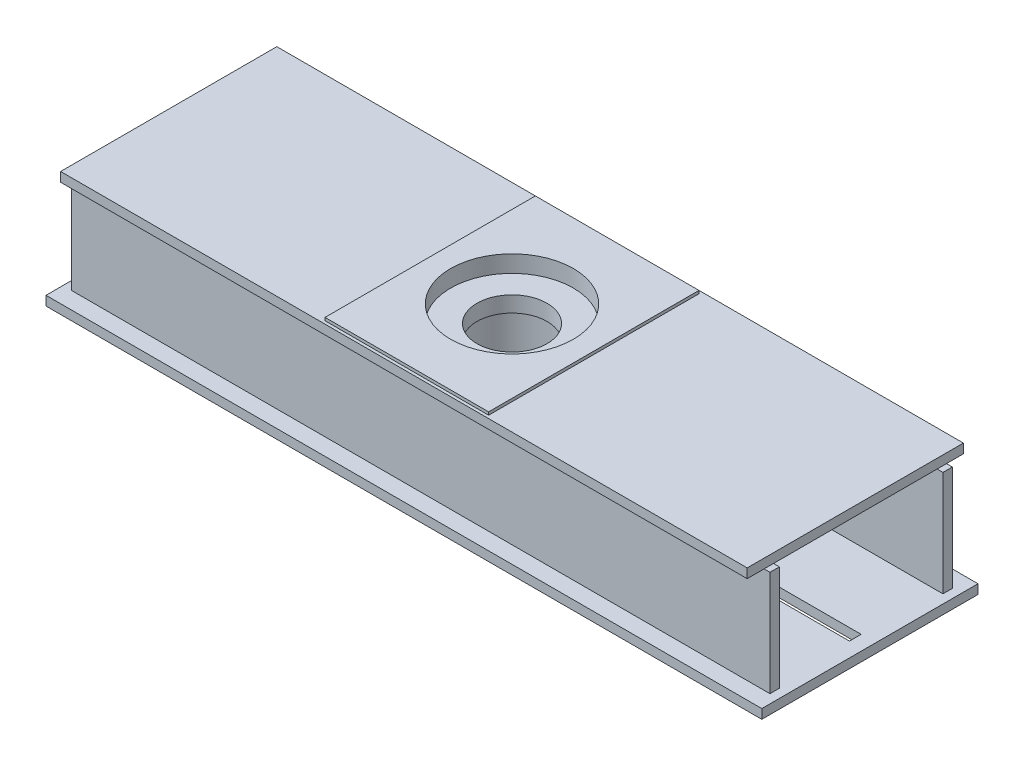
from build123d import *

# Parameters (mm, degrees)
SKETCH_1_W               = 1175
SKETCH_1_H               = 370
SKETCH_1_R               = 105
EXTRUDE_1_DEPTH          = 16
SKETCH_6_W               = 280
SKETCH_6_H               = 360
SKETCH_6_R               = 105
EXTRUDE_5_DEPTH          = 5
EXTRUDE_START            = 8
SKETCH_7_W               = 280
SKETCH_7_H               = 280
SKETCH_7_R               = 105
EXTRUDE_6_DEPTH          = 8
SKETCH_8_W               = 280
SKETCH_8_H               = 280
SKETCH_8_R               = 60
EXTRUDE_7_DEPTH          = 27
SKETCH_9_R               = 85
SKETCH_9_R_2             = 75
EXTRUDE_8_DEPTH          = 135
EXTRUDE_9_DEPTH          = 135
PATTERN_CIRCULAR_1_COUNT = 8
SKETCH_11_W              = 280
SKETCH_11_H              = 280
EXTRUDE_10_DEPTH         = 10
SKETCH_15_W              = 1195
SKETCH_15_H              = 16
EXTRUDE_14_DEPTH         = 180
EXTRUDE_14_2_DEPTH       = 180
SKETCH_16_W              = 1225
SKETCH_16_H              = 370
EXTRUDE_39_DEPTH         = 16
SKETCH_17_W              = 447.5
SKETCH_17_H              = 20
CUT_EXTRUDE_1_DEPTH      = 16


with BuildPart() as part:
    # 草图1 → 凸台-拉伸1 (new body)
    with BuildSketch(Plane(origin=(0, 0, 0), x_dir=(1, 0, 0), z_dir=(0, 1, 0))):
        Rectangle(SKETCH_1_W, SKETCH_1_H)
        with Locations(Location((0, 0, 0), (0, 0, 270))):
            Circle(SKETCH_1_R, mode=Mode.SUBTRACT)
    extrude(amount=EXTRUDE_1_DEPTH)

    # 草图6 → 凸台-拉伸5 (add)
    with BuildSketch(Plane(origin=(0, 16, 0), x_dir=(1, 0, 0), z_dir=(0, 1, 0))):
        Rectangle(SKETCH_6_W, SKETCH_6_H)
        with Locations(Location((0, 0, 0), (0, 0, 270))):
            Circle(SKETCH_6_R, mode=Mode.SUBTRACT)
    extrude(amount=EXTRUDE_5_DEPTH)

    # 草图7 → 凸台-拉伸6 (add)
    with BuildSketch(Plane.XZ.offset(EXTRUDE_START)):
        Rectangle(SKETCH_7_W, SKETCH_7_H)
        with Locations(Location((0, 0, 0), (0, 0, 270))):
            Circle(SKETCH_7_R, mode=Mode.SUBTRACT)
    extrude(amount=-EXTRUDE_6_DEPTH)

    # 草图8 → 凸台-拉伸7 (add)
    with BuildSketch(Plane.XZ.offset(8)):
        Rectangle(SKETCH_8_W, SKETCH_8_H)
        with Locations(Location((0, 0, 0), (0, 0, 270))):
            Circle(SKETCH_8_R, mode=Mode.SUBTRACT)
    extrude(amount=EXTRUDE_7_DEPTH)

    # 草图9 → 凸台-拉伸8 (add)
    with BuildSketch(Plane.XZ.offset(35)):
        with Locations(Location((0, 0, 0), (0, 0, 270))):
            Circle(SKETCH_9_R)
        with Locations(Location((0, 0, 0), (0, 0, 270))):
            Circle(SKETCH_9_R_2, mode=Mode.SUBTRACT)
    extrude(amount=EXTRUDE_8_DEPTH)

    # 草图10 → 凸台-拉伸9 (add)
    with BuildSketch(Plane(origin=(0, -35, 0), x_dir=(-1, 0, 0), z_dir=(0, -1, 0))):
        with BuildLine():
            Line((61.816733056, -136.173165676), (52.577937731, -140))
            Line((52.577937731, -140), (27.852368346, -80.307195054))
            ThreePointArc((27.852368346, -80.307195054), (32.528091751, -78.529760263), (37.091163671, -76.480360731))
            Line((37.091163671, -76.480360731), (61.816733056, -136.173165676))
        make_face()
    extrude_9 = extrude(amount=EXTRUDE_9_DEPTH)

    # 阵列(圆周)1: 凸台-拉伸9 ×8 about axis
    pattern_circular_1_axis = Axis((0, 0, 0), (0, 1, 0))
    for i in range(1, PATTERN_CIRCULAR_1_COUNT):
        add(extrude_9.rotate(pattern_circular_1_axis, i * 360 / PATTERN_CIRCULAR_1_COUNT))

    # 草图11 → 凸台-拉伸10 (add)
    with BuildSketch(Plane.XZ.offset(170)):
        Rectangle(SKETCH_11_W, SKETCH_11_H)
    extrude(amount=EXTRUDE_10_DEPTH)


with BuildPart() as body_2:
    # 草图15 → 凸台-拉伸14 (new body)
    with BuildSketch(Plane(origin=(0, -180, 0), x_dir=(-1, 0, 0), z_dir=(0, -1, 0))):
        with Locations((0, -148)):
            Rectangle(SKETCH_15_W, SKETCH_15_H)
    extrude(amount=-EXTRUDE_14_DEPTH)


with BuildPart() as body_3:
    # 草图15 → Extrude 14 2 (new body)
    with BuildSketch(Plane(origin=(0, -180, 0), x_dir=(-1, 0, 0), z_dir=(0, -1, 0))):
        with Locations((0, 148)):
            Rectangle(SKETCH_15_W, SKETCH_15_H)
    extrude(amount=-EXTRUDE_14_2_DEPTH)


with BuildPart() as body_4:
    # 草图16 → 凸台-拉伸39 (new body)
    with BuildSketch(Plane.XZ.offset(196)):
        Rectangle(SKETCH_16_W, SKETCH_16_H)
    extrude(amount=-EXTRUDE_39_DEPTH)

    # 草图17 → 切除-拉伸1 (cut)
    with BuildSketch(Plane.XZ.offset(196)):
        with Locations((-363.75, 0)):
            Rectangle(SKETCH_17_W, SKETCH_17_H)
        with Locations((363.75, 0)):
            Rectangle(SKETCH_17_W, SKETCH_17_H)
    extrude(amount=-CUT_EXTRUDE_1_DEPTH, mode=Mode.SUBTRACT)


solid = Compound([part.part, body_2.part, body_3.part, body_4.part])
